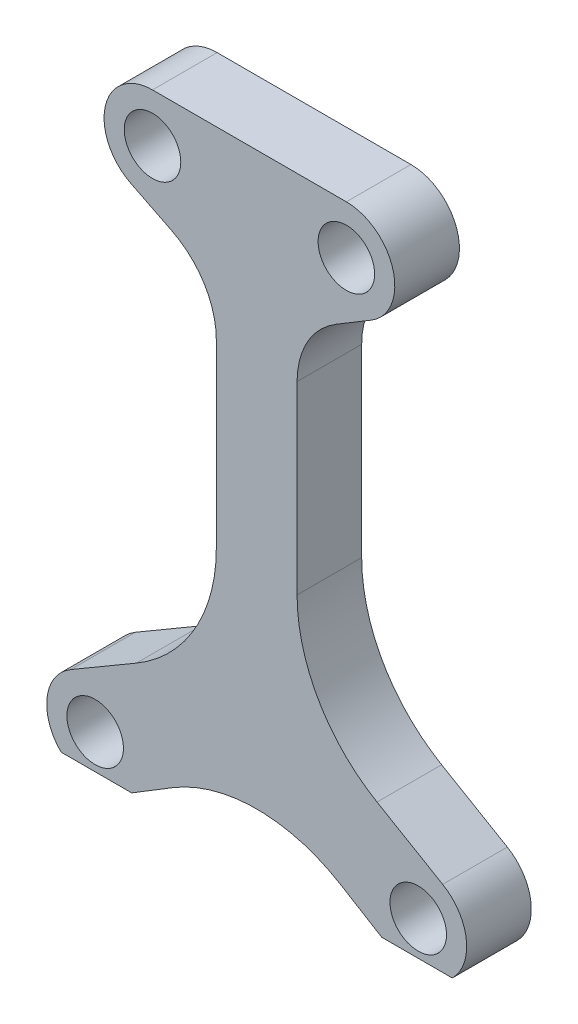
from build123d import *

# Parameters (mm, degrees)
SKETCH_1_W          = 28
SKETCH_1_H          = 40
EXTRUDE_1_DEPTH     = 4
SKETCH_2_R          = 1.75
CUT_EXTRUDE_1_DEPTH = 49.989794856
SKETCH_3_W          = 46.756275812
SKETCH_3_H          = 48.920918211
CUT_EXTRUDE_2_DEPTH = 49.989794856


with BuildPart() as part:
    # 草图1 → 凸台-拉伸1 (new body)
    with BuildSketch(Plane.XY):
        with Locations((14, 20)):
            Rectangle(SKETCH_1_W, SKETCH_1_H)
    extrude(amount=EXTRUDE_1_DEPTH)

    # 草图2 → 切除-拉伸1 (cut, through all)
    with BuildSketch(Plane.XY.offset(4)):
        with Locations((7.55, 35.334562065)):
            Circle(SKETCH_2_R)
        with Locations((19.55, 35.334562065)):
            Circle(SKETCH_2_R)
        with Locations((4, 2.134562065)):
            Circle(SKETCH_2_R)
        with Locations((24, 2.134562065)):
            Circle(SKETCH_2_R)
    extrude(amount=-CUT_EXTRUDE_1_DEPTH, mode=Mode.SUBTRACT)

    # 草图3 → 切除-拉伸2 (cut, through all)
    with BuildSketch(Plane.XY.offset(4)):
        with Locations((16.027589169, 19.550398151)):
            Rectangle(SKETCH_3_W, SKETCH_3_H)
        with BuildLine():
            Line((11.5, 26.912679478), (11.5, 15.734177946))
            ThreePointArc((11.5, 15.734177946), (10.174988112, 10.759785395), (6.551083749, 7.103618696))
            Line((6.551083749, 7.103618696), (2.484674875, 4.72372984))
            ThreePointArc((2.484674875, 4.72372984), (1.424970874, 0.595333362), (5.563000373, -0.426107736))
            Line((5.563000373, -0.426107736), (8.789998756, 1.543611152))
            ThreePointArc((8.789998756, 1.543611152), (14, 3.008045147), (19.210001244, 1.543611152))
            Line((19.210001244, 1.543611152), (22.436999627, -0.426107736))
            ThreePointArc((22.436999627, -0.426107736), (26.575029126, 0.595333362), (25.515325125, 4.72372984))
            Line((25.515325125, 4.72372984), (21.448916251, 7.103618696))
            ThreePointArc((21.448916251, 7.103618696), (17.825011888, 10.759785395), (16.5, 15.734177946))
            Line((16.5, 15.734177946), (16.5, 27.172210605))
            ThreePointArc((16.5, 27.172210605), (17.147820732, 29.633619881), (18.923414249, 31.457208372))
            Line((18.923414249, 31.457208372), (21.095951451, 32.763563405))
            ThreePointArc((21.095951451, 32.763563405), (22.440760798, 36.136747835), (19.55, 38.334562065))
            Line((19.55, 38.334562065), (7.55, 38.334562065))
            ThreePointArc((7.55, 38.334562065), (4.630537584, 36.025025097), (6.206146085, 32.652388198))
            Line((6.206146085, 32.652388198), (8.739756525, 31.382969257))
            ThreePointArc((8.739756525, 31.382969257), (10.754337941, 29.539580444), (11.5, 26.912679478))
        make_face(mode=Mode.SUBTRACT)
    extrude(amount=-CUT_EXTRUDE_2_DEPTH, mode=Mode.SUBTRACT)


solid = part.part
